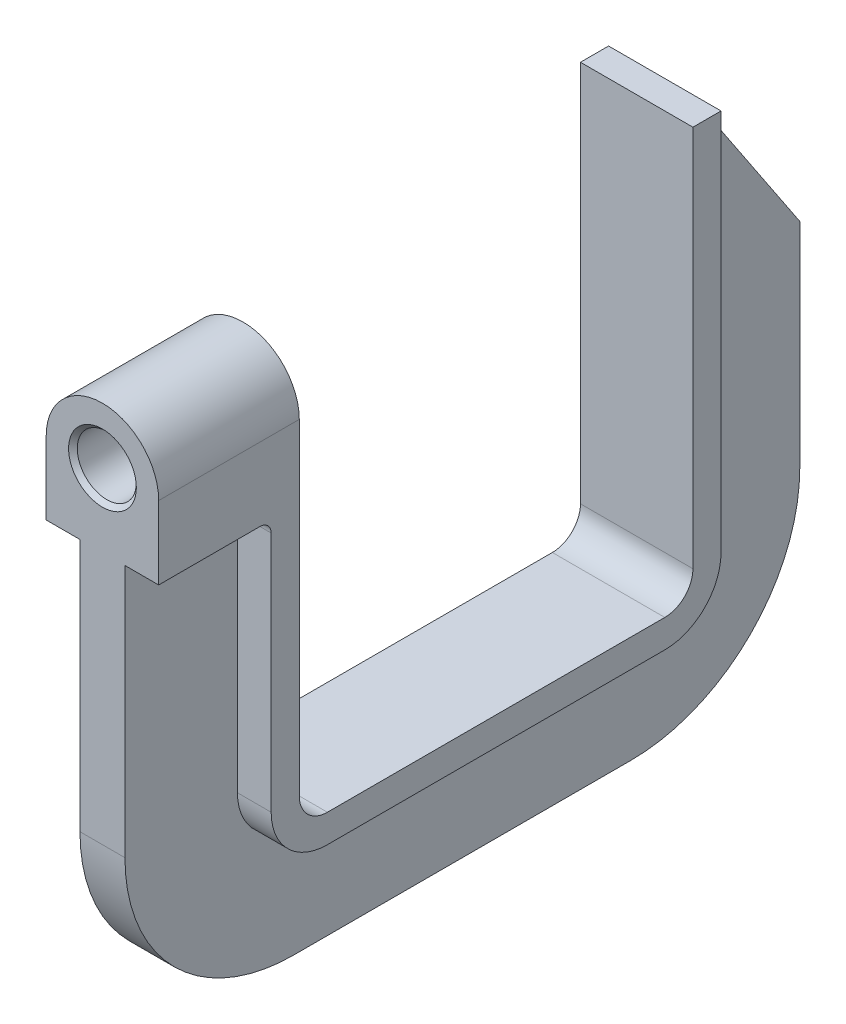
from build123d import *

# Parameters (mm, degrees)
BOSS_EXTRUDE2_DEPTH              = 4
BOSS_EXTRUDE3_DEPTH              = 10
BOSS_EXTRUDE6_DEPTH              = 25
CUT_EXTRUDE3_DEPTH               = 25
M12X1_5_TAPPED_HOLE1_D           = 10.5
M12X1_5_TAPPED_HOLE1_DEPTH       = 25
M12X1_5_TAPPED_HOLE1_CSINK_D     = 12.05
M12X1_5_TAPPED_HOLE1_CSINK_ANGLE = 90
FILLET1_R                        = 2


with BuildPart() as part:
    # Sketch1 → Boss-Extrude2 (new, symmetric)
    with BuildSketch(Plane(origin=(0, 0, 0), x_dir=(0, 0, -1), z_dir=(1, 0, 0))):
        with BuildLine():
            ThreePointArc((-65, -98), (-86.213203, -89.213203), (-95, -68))
            Line((-95, -68), (-95, 0))
            Line((-95, 0), (-75, 0))
            Line((-75, 0), (-75, -68))
            ThreePointArc((-75, -68), (-72.071068, -75.071068), (-65, -78))
            Line((-65, -78), (-5, -78))
            ThreePointArc((-5, -78), (2.071068, -75.071068), (5, -68))
            Line((5, -68), (5, 0))
            Line((5, 0), (25, -30))
            Line((25, -30), (25, -68))
            ThreePointArc((25, -68), (16.213203, -89.213203), (-5, -98))
            Line((-5, -98), (-65, -98))
        make_face()
    extrude(amount=BOSS_EXTRUDE2_DEPTH, both=True)

    # Sketch1<5> → Boss-Extrude3 (add, symmetric)
    with BuildSketch(Plane(origin=(0, 0, 0), x_dir=(0, 0, -1), z_dir=(1, 0, 0))):
        with BuildLine():
            ThreePointArc((-65, -78), (-72.071068, -75.071068), (-75, -68))
            Line((-75, -68), (-75, 0))
            Line((-75, 0), (-70, 0))
            Line((-70, 0), (-70, -68))
            ThreePointArc((-70, -68), (-68.535534, -71.535534), (-65, -73))
            Line((-65, -73), (-5, -73))
            ThreePointArc((-5, -73), (-1.464466, -71.535534), (0, -68))
            Line((0, -68), (0, 0))
            Line((0, 0), (5, 0))
            Line((5, 0), (5, -68))
            ThreePointArc((5, -68), (2.071068, -75.071068), (-5, -78))
            Line((-5, -78), (-65, -78))
        make_face()
    extrude(amount=BOSS_EXTRUDE3_DEPTH, both=True)

    # Sketch2 → Boss-Extrude6 (add)
    with BuildSketch(Plane.XY.offset(95)):
        with BuildLine():
            Line((-10, -10), (-10, -23))
            Line((-10, -23), (10, -23))
            Line((10, -23), (10, -10))
            ThreePointArc((10, -10), (0, 0), (-10, -10))
        make_face()
    extrude(amount=-BOSS_EXTRUDE6_DEPTH)

    # Sketch4 → Cut-Extrude3 (cut)
    with BuildSketch(Plane.XY.offset(95)):
        with BuildLine():
            Line((10, 0), (4, 0))
            Line((4, 0), (4, -0.834849))
            ThreePointArc((4, -0.834849), (8.3666, -4.522774), (10, -10))
            Line((10, -10), (10, 0))
        make_face()
        with BuildLine():
            Line((-10, 0), (-10, -10))
            ThreePointArc((-10, -10), (-8.3666, -4.522774), (-4, -0.834849))
            Line((-4, -0.834849), (-4, 0))
            Line((-4, 0), (-10, 0))
        make_face()
        with BuildLine():
            Line((-4, 0), (-4, -0.834849))
            ThreePointArc((-4, -0.834849), (-2.043096, -0.210937), (0, 0))
            Line((0, 0), (-4, 0))
        make_face()
        with BuildLine():
            Line((4, 0), (0, 0))
            ThreePointArc((0, 0), (2.043096, -0.210937), (4, -0.834849))
            Line((4, -0.834849), (4, 0))
        make_face()
    extrude(amount=-CUT_EXTRUDE3_DEPTH, mode=Mode.SUBTRACT)

    # M12x1.5 Tapped Hole1
    with Locations(Plane.XY.offset(95)):
        with Locations((0, -10)):
            CounterSinkHole(M12X1_5_TAPPED_HOLE1_D / 2, M12X1_5_TAPPED_HOLE1_CSINK_D / 2, depth=M12X1_5_TAPPED_HOLE1_DEPTH, counter_sink_angle=M12X1_5_TAPPED_HOLE1_CSINK_ANGLE)

    # Fillet1
    fillet1_edges = [part.edges().sort_by_distance(p)[0] for p in [
        (-7, -23, 75),
        (7, -23, 75),
    ]]
    fillet(fillet1_edges, radius=FILLET1_R)


solid = part.part
